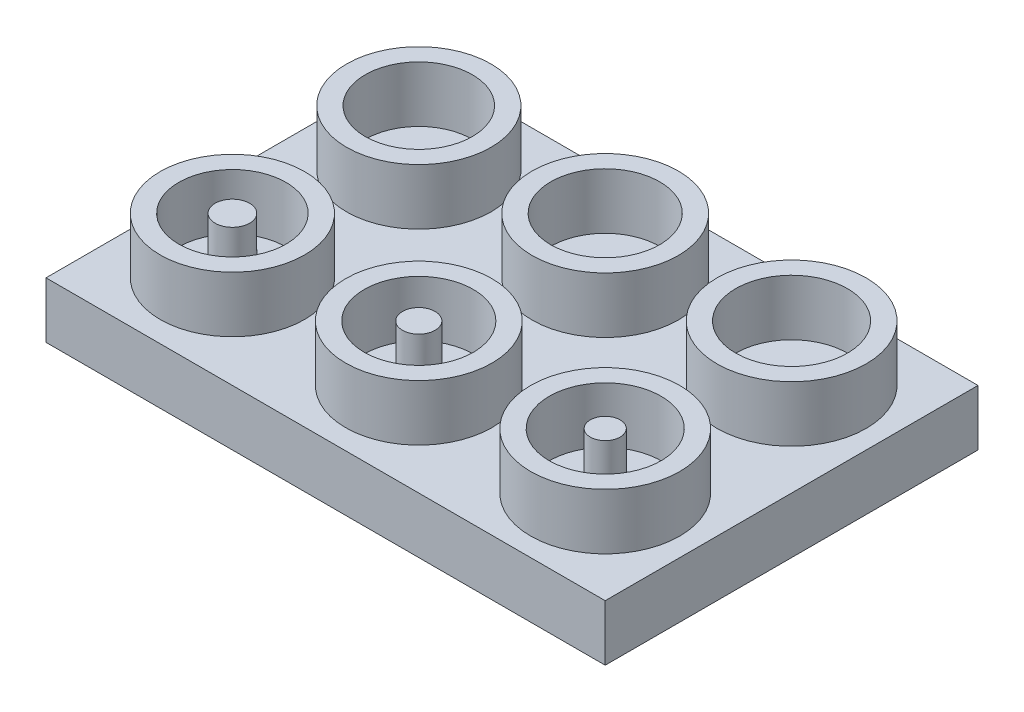
from build123d import *

# Parameters (mm, degrees)
SKETCH1_W           = 30
SKETCH1_H           = 20
BOSS_EXTRUDE1_DEPTH = 3
SKETCH2_R           = 3.875
SKETCH2_R_2         = 2.875
SKETCH2_R_3         = 3.925
SKETCH2_R_4         = 2.925
SKETCH2_R_5         = 4
SKETCH2_R_6         = 3
SKETCH2_R_7         = 0.925
SKETCH2_R_8         = 0.875
SKETCH2_R_9         = 0.8
BOSS_EXTRUDE2_DEPTH = 3
SKETCH4_W           = 3.175
SKETCH4_H           = 0.284935898
SKETCH4_H_2         = 0.284935897
CUT_EXTRUDE1_DEPTH  = 2


with BuildPart() as part:
    # Sketch1 → Boss-Extrude1 (new body)
    with BuildSketch(Plane(origin=(0, 0, 0), x_dir=(1, 0, 0), z_dir=(0, 1, 0))):
        Rectangle(SKETCH1_W, SKETCH1_H)
    extrude(amount=BOSS_EXTRUDE1_DEPTH)

    # Sketch2 → Boss-Extrude2 (add)
    # profile 1 of 9: a face of its own
    with BuildSketch(Plane(origin=(0, 3, 0), x_dir=(1, 0, 0), z_dir=(0, 1, 0))):
        with Locations(Location((-10, 5, 0), (0, 0, 90))):
            Circle(SKETCH2_R)
        with Locations(Location((-10, 5, 0), (0, 0, 270))):
            Circle(SKETCH2_R_2, mode=Mode.SUBTRACT)
    # profile 2 of 9: a face of its own
    with BuildSketch(Plane(origin=(0, 3, 0), x_dir=(1, 0, 0), z_dir=(0, 1, 0))):
        with Locations(Location((0, 5, 0), (0, 0, 90))):
            Circle(SKETCH2_R_3)
        with Locations(Location((0, 5, 0), (0, 0, 270))):
            Circle(SKETCH2_R_4, mode=Mode.SUBTRACT)
    # profile 3 of 9: a face of its own
    with BuildSketch(Plane(origin=(0, 3, 0), x_dir=(1, 0, 0), z_dir=(0, 1, 0))):
        with Locations(Location((10, 5, 0), (0, 0, 90))):
            Circle(SKETCH2_R_5)
        with Locations(Location((10, 5, 0), (0, 0, 270))):
            Circle(SKETCH2_R_6, mode=Mode.SUBTRACT)
    # profile 4 of 9: a face of its own
    with BuildSketch(Plane(origin=(0, 3, 0), x_dir=(1, 0, 0), z_dir=(0, 1, 0))):
        with Locations(Location((-10, -5, 0), (0, 0, 90))):
            Circle(SKETCH2_R)
        with Locations(Location((-10, -5, 0), (0, 0, 270))):
            Circle(SKETCH2_R_2, mode=Mode.SUBTRACT)
    # profile 5 of 9: a face of its own
    with BuildSketch(Plane(origin=(0, 3, 0), x_dir=(1, 0, 0), z_dir=(0, 1, 0))):
        with Locations(Location((-10, -5, 0), (0, 0, 90))):
            Circle(SKETCH2_R_7)
    # profile 6 of 9: a face of its own
    with BuildSketch(Plane(origin=(0, 3, 0), x_dir=(1, 0, 0), z_dir=(0, 1, 0))):
        with Locations(Location((0, -5, 0), (0, 0, 90))):
            Circle(SKETCH2_R_3)
        with Locations(Location((0, -5, 0), (0, 0, 270))):
            Circle(SKETCH2_R_4, mode=Mode.SUBTRACT)
    # profile 7 of 9: a face of its own
    with BuildSketch(Plane(origin=(0, 3, 0), x_dir=(1, 0, 0), z_dir=(0, 1, 0))):
        with Locations(Location((0, -5, 0), (0, 0, 90))):
            Circle(SKETCH2_R_8)
    # profile 8 of 9: a face of its own
    with BuildSketch(Plane(origin=(0, 3, 0), x_dir=(1, 0, 0), z_dir=(0, 1, 0))):
        with Locations(Location((10, -5, 0), (0, 0, 90))):
            Circle(SKETCH2_R_5)
        with Locations(Location((10, -5, 0), (0, 0, 270))):
            Circle(SKETCH2_R_6, mode=Mode.SUBTRACT)
    # profile 9 of 9: a face of its own
    with BuildSketch(Plane(origin=(0, 3, 0), x_dir=(1, 0, 0), z_dir=(0, 1, 0))):
        with Locations(Location((10, -5, 0), (0, 0, 90))):
            Circle(SKETCH2_R_9)
    extrude(amount=BOSS_EXTRUDE2_DEPTH)

    # Sketch4 → Cut-Extrude1 (cut)
    # profile 1 of 16: a face of its own
    with BuildSketch(Plane(origin=(0, 0, 0), x_dir=(-1, 0, 0), z_dir=(0, -1, 0))):
        Polygon((6.825, -6.390705128), (6.825, -6.105769231), (9.674358974, -6.105769231), (9.674358974, -4.884615385), (10, -4.884615385), (10, -6.390705128), align=None)
    # profile 2 of 16: a face of its own
    with BuildSketch(Plane(origin=(0, 0, 0), x_dir=(-1, 0, 0), z_dir=(0, -1, 0))):
        with BuildLine():
            add(Edge.make_bspline(
                [(6.743589744, -2.869711538), (6.745053732, -2.810914918), (6.747929127, -2.695433505), (6.770666469, -2.525868981), (6.808089755, -2.363503347), (6.860939426, -2.20824326), (6.929452383, -2.060679212), (7.012676005, -1.920394444), (7.111116057, -1.787809375), (7.223327043, -1.663836641), (7.346216385, -1.550744787), (7.477771756, -1.451506099), (7.616339159, -1.3677889), (7.76192582, -1.299257254), (7.914191835, -1.24545537), (8.073990577, -1.208338562), (8.240275413, -1.184626813), (8.353692712, -1.181854884), (8.411227965, -1.180448718)],
                knots=[0, 0, 0, 0, 1.065064174, 2.09187391, 3.093564831, 4.079973196, 5.057907931, 6.036227367, 7.030399151, 8.044883615, 9.061699972, 10.052012555, 11.025713132, 11.989727027, 12.962874294, 13.945865945, 14.957962116, 16, 16, 16, 16], degree=3))
            add(Edge.make_bspline(
                [(8.411227965, -1.180448718), (8.468339066, -1.181855358), (8.580911664, -1.184628008), (8.746146033, -1.208357802), (8.904962724, -1.245620987), (9.057007756, -1.298591113), (9.202298725, -1.367175347), (9.340971027, -1.451015791), (9.472877784, -1.550066136), (9.596613733, -1.662677743), (9.709803478, -1.785801191), (9.809641242, -1.916850957), (9.893394885, -2.055414665), (9.962691624, -2.200056385), (10.015372285, -2.351911889), (10.053725545, -2.509876123), (10.077201904, -2.674809729), (10.079992079, -2.787163952), (10.081410256, -2.844270833)],
                knots=[0, 0, 0, 0, 1.043748596, 2.057349401, 3.045489418, 4.02252776, 4.995289225, 5.97782527, 6.980224157, 8.006516136, 9.032559198, 10.034193337, 11.013412982, 11.987833483, 12.961212594, 13.946489799, 14.956251404, 16, 16, 16, 16], degree=3))
            add(Edge.make_bspline(
                [(10.081410256, -2.844270833), (10.080004741, -2.901805751), (10.077234097, -3.01522239), (10.053483822, -3.181716701), (10.016344211, -3.341625797), (9.963267794, -3.494492387), (9.894672163, -3.640401716), (9.811029619, -3.779639148), (9.711781713, -3.911645803), (9.599144891, -4.035327245), (9.476524983, -4.148492589), (9.345139623, -4.247152879), (9.207566459, -4.330814232), (9.063423705, -4.399179541), (8.913408182, -4.453303729), (8.756519206, -4.490228814), (8.593651226, -4.514119285), (8.482759454, -4.516872324), (8.426492388, -4.518269231)],
                knots=[0, 0, 0, 0, 1.053102029, 2.075944431, 3.073151272, 4.055350789, 5.033113405, 6.020478099, 7.024410459, 8.052272461, 9.079885166, 10.07527673, 11.055994387, 12.023226415, 12.992069828, 13.970394897, 14.97016774, 16, 16, 16, 16], degree=3))
            add(Edge.make_bspline(
                [(8.426492388, -4.518269231), (8.388725609, -4.51778424), (8.313668497, -4.516820377), (8.202210939, -4.505216484), (8.092545842, -4.48837837), (7.984985053, -4.464246635), (7.879791874, -4.432685623), (7.776240825, -4.395445569), (7.675381304, -4.349961567), (7.576735513, -4.298544122), (7.481841199, -4.241156624), (7.392143291, -4.177769337), (7.306889101, -4.110608682), (7.228287891, -4.036981889), (7.154053074, -3.959315542), (7.085325466, -3.876349728), (7.021485332, -3.788590692), (6.963954023, -3.695660819), (6.911921094, -3.599849955), (6.867269843, -3.501083164), (6.82894663, -3.400701845), (6.79788531, -3.298235843), (6.773363392, -3.193957257), (6.756665292, -3.087638495), (6.745031804, -2.979364259), (6.744072499, -2.906419705), (6.743589744, -2.869711538)],
                knots=[0, 0, 0, 0, 1.037015668, 2.060948919, 3.074880161, 4.083647147, 5.086022904, 6.090072063, 7.104153813, 8.122640571, 9.144368836, 10.147691507, 11.138137339, 12.123020368, 13.103399296, 14.087645067, 15.080126199, 16.082011238, 17.087798457, 18.072939717, 19.057185487, 20.037253025, 21.01195951, 21.997135196, 22.992090687, 24, 24, 24, 24], degree=3))
        make_face()
        with BuildLine():
            add(Edge.make_bspline(
                [(7.069230769, -2.855719151), (7.069596782, -2.885849954), (7.070325307, -2.945823507), (7.079974217, -3.034975925), (7.093627875, -3.122982915), (7.113457775, -3.209674172), (7.139106888, -3.295231504), (7.170041743, -3.379692894), (7.207431151, -3.462768753), (7.249480084, -3.544355294), (7.297240944, -3.622568137), (7.347958314, -3.697595641), (7.403516616, -3.767486276), (7.46271432, -3.833200144), (7.526065168, -3.894573821), (7.593153129, -3.951580236), (7.664268376, -4.004172642), (7.73911824, -4.051718112), (7.817284818, -4.094029868), (7.897273901, -4.131913358), (7.980025528, -4.163317325), (8.065023303, -4.188193946), (8.151892661, -4.209308497), (8.241106896, -4.222553106), (8.332358456, -4.232297088), (8.394028061, -4.232985259), (8.425220353, -4.233333333)],
                knots=[0, 0, 0, 0, 1.008406545, 2.007172654, 2.999155034, 3.989332444, 4.982025741, 5.988181096, 6.998684226, 8.030553839, 9.059268815, 10.065399129, 11.060956322, 12.046057109, 13.024974577, 14.012068307, 14.991706172, 15.984221787, 16.978487447, 17.966117052, 18.945677757, 19.938371053, 20.93015022, 21.936155317, 22.956113857, 24, 24, 24, 24], degree=3))
            add(Edge.make_bspline(
                [(8.425220353, -4.233333333), (8.471086467, -4.232174205), (8.561319304, -4.229893842), (8.693566713, -4.210012941), (8.82078581, -4.179145879), (8.94221832, -4.134394468), (9.058405743, -4.077305214), (9.16889592, -4.007667914), (9.273656257, -3.924844836), (9.371906919, -3.830820429), (9.46154849, -3.728007218), (9.540343902, -3.618887045), (9.606660318, -3.504323229), (9.662099352, -3.384976085), (9.703864813, -3.259826648), (9.733643568, -3.129677329), (9.752944025, -2.99452525), (9.754818558, -2.902426941), (9.755769231, -2.855719151)],
                knots=[0, 0, 0, 0, 1.032022337, 2.030307203, 3.003823408, 3.974715386, 4.937372378, 5.913284036, 6.909147208, 7.938749767, 8.970518239, 9.975863271, 10.963918693, 11.946286286, 12.933361397, 13.927862637, 14.949112547, 16, 16, 16, 16], degree=3))
            add(Edge.make_bspline(
                [(9.755769231, -2.855719151), (9.755338228, -2.824323265), (9.754483421, -2.762055794), (9.745861665, -2.669442381), (9.732063322, -2.57848888), (9.712098419, -2.489363342), (9.687441963, -2.401948994), (9.65685817, -2.316509595), (9.620195533, -2.233073524), (9.579336237, -2.151230506), (9.532921178, -2.072813087), (9.482887526, -1.998240684), (9.428309529, -1.92847046), (9.369906876, -1.862787424), (9.306750767, -1.801843872), (9.240070525, -1.744999765), (9.168804343, -1.693316697), (9.094261047, -1.645932408), (9.016664351, -1.603104383), (8.936455361, -1.566316684), (8.854064264, -1.534899228), (8.769430526, -1.509573199), (8.682744523, -1.489717497), (8.593882189, -1.476038524), (8.503023455, -1.466469403), (8.441570086, -1.465748179), (8.410591947, -1.465384615)],
                knots=[0, 0, 0, 0, 1.047334373, 2.07717862, 3.100662057, 4.115010574, 5.122652213, 6.129548646, 7.140165612, 8.16200981, 9.179904151, 10.178566626, 11.156366481, 12.133321541, 13.108841334, 14.082538371, 15.054589433, 16.043660176, 17.028268541, 18.009491307, 18.985652105, 19.968123554, 20.954864208, 21.950389976, 22.966808393, 24, 24, 24, 24], degree=3))
            add(Edge.make_bspline(
                [(8.410591947, -1.465384615), (8.37982574, -1.465748482), (8.3187953, -1.466470279), (8.228570129, -1.476033809), (8.140347573, -1.489732474), (8.05447398, -1.50947436), (7.97092746, -1.534919855), (7.889786487, -1.566295508), (7.810748748, -1.603293589), (7.734009707, -1.645755384), (7.660372357, -1.693485271), (7.589976871, -1.745641437), (7.524139338, -1.803120344), (7.461256664, -1.864294788), (7.402586635, -1.930635533), (7.34835594, -2.002154158), (7.296121127, -2.077069942), (7.249892738, -2.157077051), (7.206987153, -2.239351069), (7.170382103, -2.323851102), (7.13894355, -2.409370364), (7.113381207, -2.496250777), (7.093703833, -2.584451276), (7.079961999, -2.673920567), (7.070328621, -2.764346353), (7.069597881, -2.825164899), (7.069230769, -2.855719151)],
                knots=[0, 0, 0, 0, 1.029877221, 2.042951179, 3.035109885, 4.018542222, 4.991021277, 5.957494829, 6.929429462, 7.911425532, 8.892163142, 9.866273635, 10.842761649, 11.81676864, 12.802607151, 13.805177466, 14.821356543, 15.858816981, 16.897175917, 17.927346774, 18.940346092, 19.946830556, 20.957962087, 21.964146003, 22.97721996, 24, 24, 24, 24], degree=3))
        make_face(mode=Mode.SUBTRACT)
    # profile 3 of 16: a face of its own
    with BuildSketch(Plane(origin=(0, 0, 0), x_dir=(-1, 0, 0), z_dir=(0, -1, 0))):
        Polygon((6.825, -0.732692308), (6.825, -0.438216146), (9.153460537, 0.183173077), (6.825, 1.107306691), (6.825, 1.148647837), (9.137560096, 2.055608974), (6.825, 2.680178285), (6.825, 2.971474359), (10, 2.115394631), (10, 2.074689503), (7.571684696, 1.119391026), (10, 0.152644231), (10, 0.111939103), align=None)
    # profile 4 of 16: a face of its own
    with BuildSketch(Plane(origin=(0, 0, 0), x_dir=(-1, 0, 0), z_dir=(0, -1, 0))):
        with BuildLine():
            add(Edge.make_bspline(
                [(8.413772035, 4.640384615), (8.362883691, 4.640682175), (8.264032348, 4.641260188), (8.119991994, 4.647690398), (7.984863732, 4.658372316), (7.858641094, 4.673011219), (7.741291491, 4.690825671), (7.63312854, 4.714606869), (7.533651586, 4.741651317), (7.442536383, 4.772995399), (7.358554894, 4.808362626), (7.280155901, 4.846857504), (7.207452134, 4.890002228), (7.139304243, 4.935350367), (7.076753039, 4.984667318), (7.019077814, 5.036895632), (6.966764954, 5.093079882), (6.919778634, 5.152675133), (6.878578488, 5.21527748), (6.842064493, 5.279176236), (6.811988111, 5.345513128), (6.787384802, 5.413414868), (6.767300553, 5.483024569), (6.753504732, 5.554324459), (6.744839858, 5.627479816), (6.744010402, 5.676856614), (6.743589744, 5.701898037)],
                knots=[0, 0, 0, 0, 1.646148282, 3.197666765, 4.66315463, 6.030252048, 7.307778049, 8.501004361, 9.610818041, 10.641065266, 11.615491391, 12.557119604, 13.464013759, 14.348536654, 15.203310953, 16.038349431, 16.863300206, 17.683791446, 18.490318933, 19.285717724, 20.06220424, 20.843281102, 21.620494212, 22.403315558, 23.190242141, 24, 24, 24, 24], degree=3))
            add(Edge.make_bspline(
                [(6.743589744, 5.701898037), (6.743940127, 5.727161038), (6.744637268, 5.777425519), (6.75444994, 5.851471189), (6.76711544, 5.92422711), (6.787428816, 5.994589431), (6.811736404, 6.063888568), (6.843809882, 6.13040119), (6.878692279, 6.196475544), (6.921245869, 6.259109963), (6.968274589, 6.320175846), (7.021664209, 6.377418736), (7.079937166, 6.432301913), (7.144393116, 6.482752463), (7.21404376, 6.530932624), (7.28947297, 6.57501343), (7.370513584, 6.615911681), (7.456789911, 6.654396155), (7.550606524, 6.688049812), (7.651378265, 6.717970603), (7.76001767, 6.742495754), (7.875919549, 6.762777622), (7.999658079, 6.778520213), (8.130982551, 6.789977404), (8.269975122, 6.796031534), (8.365005487, 6.797171445), (8.413772035, 6.79775641)],
                knots=[0, 0, 0, 0, 0.810910589, 1.61342667, 2.396193133, 3.181089899, 3.963115317, 4.752255436, 5.550715454, 6.36105385, 7.181178335, 8.024612154, 8.872680183, 9.750181803, 10.651284446, 11.591556747, 12.554036451, 13.566402641, 14.62422919, 15.753422176, 16.94128843, 18.199818041, 19.531985927, 20.947085226, 22.433341622, 24, 24, 24, 24], degree=3))
            add(Edge.make_bspline(
                [(8.413772035, 6.79775641), (8.462325441, 6.797158575), (8.557141539, 6.79599111), (8.695515231, 6.790107249), (8.826131835, 6.778240367), (8.949130608, 6.763612941), (9.064568578, 6.743104384), (9.172370524, 6.718393269), (9.272918116, 6.690238628), (9.365490942, 6.656068478), (9.451617553, 6.618479761), (9.532062281, 6.577625398), (9.607471571, 6.533793347), (9.677305929, 6.486335776), (9.741503164, 6.435055366), (9.799975986, 6.380210657), (9.853705187, 6.322467969), (9.901252024, 6.261046083), (9.944129596, 6.197828263), (9.980277855, 6.131747196), (10.011598201, 6.064494072), (10.037205473, 5.995397434), (10.057064212, 5.924563963), (10.070716013, 5.851758175), (10.08031218, 5.77741507), (10.081042964, 5.727157543), (10.081410256, 5.701898037)],
                knots=[0, 0, 0, 0, 1.561645053, 3.049612875, 4.452756685, 5.778837748, 7.032101753, 8.221335837, 9.334924186, 10.387562255, 11.392109817, 12.355697819, 13.287721948, 14.19548756, 15.068665045, 15.927346723, 16.771751757, 17.602390507, 18.423119567, 19.225778204, 20.022010933, 20.807278863, 21.593079439, 22.384715467, 23.188155646, 24, 24, 24, 24], degree=3))
            add(Edge.make_bspline(
                [(10.081410256, 5.701898037), (10.080987205, 5.676857162), (10.080153031, 5.627481445), (10.071522718, 5.554318173), (10.057647511, 5.483304814), (10.038219593, 5.414090942), (10.014438985, 5.346321471), (9.983456742, 5.280919799), (9.947775018, 5.217158983), (9.907139569, 5.155208197), (9.860581952, 5.096235128), (9.809094419, 5.039894255), (9.751356655, 4.987653061), (9.68827768, 4.938763733), (9.620028397, 4.892936183), (9.546563005, 4.850164286), (9.46775606, 4.810862141), (9.383110858, 4.774890671), (9.29134896, 4.742997949), (9.191618431, 4.714935468), (9.082906305, 4.692522826), (8.965764536, 4.673524648), (8.8399551, 4.658301158), (8.705432482, 4.647694834), (8.562452128, 4.64126507), (8.464236452, 4.640683456), (8.413772035, 4.640384615)],
                knots=[0, 0, 0, 0, 0.810927267, 1.598990287, 2.382942141, 3.152806972, 3.926217614, 4.706701772, 5.493896336, 6.292070767, 7.104102563, 7.925577746, 8.761822141, 9.623241997, 10.509042271, 11.423174113, 12.375371989, 13.360203808, 14.400680605, 15.520553799, 16.714061498, 17.994519714, 19.364400916, 20.818312473, 22.365209998, 24, 24, 24, 24], degree=3))
        make_face()
        with BuildLine():
            add(Edge.make_bspline(
                [(8.4125, 4.925320513), (8.454907579, 4.925431244), (8.537212362, 4.925646153), (8.656603995, 4.931097997), (8.768147671, 4.938686409), (8.871799856, 4.948233068), (8.967198289, 4.962530547), (9.054739575, 4.978751911), (9.134261677, 4.998208447), (9.206459525, 5.021342534), (9.272355467, 5.04769451), (9.333705866, 5.076415721), (9.391237837, 5.107543878), (9.4448118, 5.141717041), (9.493772872, 5.179610838), (9.539362103, 5.219468507), (9.579993941, 5.263085615), (9.628733605, 5.323411327), (9.679096573, 5.403056538), (9.72295363, 5.503404712), (9.750514796, 5.606518331), (9.754019783, 5.676505524), (9.755769231, 5.711438301)],
                knots=[0, 0, 0, 0, 1.459098681, 2.831824031, 4.11146945, 5.306290378, 6.412266529, 7.42953815, 8.369053297, 9.227277979, 10.03601793, 10.809473603, 11.557037441, 12.285528272, 12.993193355, 13.685654407, 14.36688038, 15.041354379, 16.352855396, 17.594313975, 18.799247529, 20, 20, 20, 20], degree=3))
            add(Edge.make_bspline(
                [(9.755769231, 5.711438301), (9.75423738, 5.746573291), (9.751179113, 5.81671864), (9.724487765, 5.919737539), (9.681096109, 6.018921351), (9.631522171, 6.097196165), (9.584009028, 6.156581001), (9.543546211, 6.199144956), (9.498226589, 6.238207401), (9.449332926, 6.275257271), (9.395926979, 6.309237928), (9.338266698, 6.340138082), (9.276191642, 6.368335112), (9.232857667, 6.384399748), (9.210702123, 6.392613181)],
                knots=[0, 0, 0, 0, 1.353621445, 2.702441307, 4.075953605, 5.516772412, 6.261413105, 7.007624062, 7.778524365, 8.566925914, 9.372323995, 10.217594641, 11.088702136, 12, 12, 12, 12], degree=3))
            add(Edge.make_bspline(
                [(9.210702123, 6.392613181), (9.182372288, 6.402185142), (9.124850574, 6.421620327), (9.035620689, 6.446668151), (8.942001039, 6.466394335), (8.844551112, 6.484141102), (8.74255224, 6.496254231), (8.63632002, 6.506004033), (8.525774356, 6.511746871), (8.450667471, 6.512458752), (8.4125, 6.512820513)],
                knots=[0, 0, 0, 0, 0.884706709, 1.796334032, 2.740027952, 3.714592787, 4.726048262, 5.777819803, 6.87074269, 8, 8, 8, 8], degree=3))
            add(Edge.make_bspline(
                [(8.4125, 6.512820513), (8.374338702, 6.512321413), (8.299687045, 6.511345066), (8.190359839, 6.507613091), (8.086521227, 6.497975992), (7.98772387, 6.487272505), (7.894514665, 6.471490742), (7.806113324, 6.454474724), (7.723614983, 6.431613649), (7.645728166, 6.407193481), (7.573337263, 6.379244352), (7.50610654, 6.348476897), (7.44370523, 6.315622219), (7.386326138, 6.279920493), (7.333636439, 6.241869008), (7.286848519, 6.200103451), (7.243686403, 6.157276244), (7.195298485, 6.096366929), (7.145571911, 6.017274331), (7.101055337, 5.918177539), (7.074709227, 5.815616632), (7.071055605, 5.746139373), (7.069230769, 5.711438301)],
                knots=[0, 0, 0, 0, 1.313483664, 2.569454835, 3.763100662, 4.901599063, 5.988328865, 7.015709358, 7.99797933, 8.932480776, 9.824041341, 10.666387587, 11.475829342, 12.24921787, 12.990555181, 13.709176526, 14.405678811, 15.080244297, 16.38186033, 17.610124501, 18.806354173, 20, 20, 20, 20], degree=3))
            add(Edge.make_bspline(
                [(7.069230769, 5.711438301), (7.071060145, 5.67631693), (7.07472223, 5.606010204), (7.100933494, 5.502354042), (7.145441664, 5.402587792), (7.195202681, 5.323234375), (7.243500879, 5.263065006), (7.284608206, 5.22036741), (7.32910856, 5.179956969), (7.378503972, 5.143044428), (7.431889166, 5.109073902), (7.488677149, 5.076742753), (7.55014218, 5.048405621), (7.615986452, 5.021969043), (7.68818827, 4.998796369), (7.767998111, 4.979562145), (7.855748452, 4.962051659), (7.95184392, 4.949441255), (8.055518227, 4.938336956), (8.167347158, 4.931181304), (8.287148771, 4.925621177), (8.369879385, 4.925422742), (8.4125, 4.925320513)],
                knots=[0, 0, 0, 0, 1.207546505, 2.417292871, 3.651582144, 4.952510111, 5.626719005, 6.30238548, 6.989136872, 7.692112372, 8.420316868, 9.164734959, 9.937886623, 10.746308695, 11.604196049, 12.543341915, 13.568754172, 14.680483261, 15.875568977, 17.154711427, 18.534182925, 20, 20, 20, 20], degree=3))
        make_face(mode=Mode.SUBTRACT)
    # profile 5 of 16: a face of its own
    with BuildSketch(Plane(origin=(0, 0, 0), x_dir=(-1, 0, 0), z_dir=(0, -1, 0))):
        Polygon((-13.175, -6.512820513), (-13.175, -6.227884615), (-11.872435897, -6.227884615), (-11.872435897, -4.599679487), (-13.175, -4.599679487), (-13.175, -4.31474359), (-10, -4.31474359), (-10, -4.599679487), (-11.546794872, -4.599679487), (-11.546794872, -6.227884615), (-10, -6.227884615), (-10, -6.512820513), align=None)
    # profile 6 of 16: a face of its own
    with BuildSketch(Plane(origin=(0, 0, 0), x_dir=(-1, 0, 0), z_dir=(0, -1, 0))):
        with Locations((-11.5875, -3.358173077)):
            Rectangle(SKETCH4_W, SKETCH4_H)
    # profile 7 of 16: a face of its own
    with BuildSketch(Plane(origin=(0, 0, 0), x_dir=(-1, 0, 0), z_dir=(0, -1, 0))):
        with BuildLine():
            add(Edge.make_bspline(
                [(-11.586227965, -1.5875), (-11.637116309, -1.587202441), (-11.735967652, -1.586624427), (-11.880008006, -1.580194217), (-12.015136268, -1.569512299), (-12.141358906, -1.554873396), (-12.258708509, -1.537058945), (-12.36687146, -1.513277747), (-12.466348414, -1.486233299), (-12.557463617, -1.454889217), (-12.641445106, -1.419521989), (-12.719844099, -1.381027111), (-12.792547866, -1.337882387), (-12.860695757, -1.292534249), (-12.923246961, -1.243217298), (-12.980922186, -1.190988984), (-13.033235046, -1.134804733), (-13.080221366, -1.075209482), (-13.121421512, -1.012607135), (-13.157935507, -0.94870838), (-13.188011889, -0.882371488), (-13.212615198, -0.814469747), (-13.232699447, -0.744860047), (-13.246495268, -0.673560157), (-13.255160142, -0.600404799), (-13.255989598, -0.551028001), (-13.256410256, -0.525986579)],
                knots=[0, 0, 0, 0, 1.646148282, 3.197666765, 4.66315463, 6.030252048, 7.307778049, 8.501004361, 9.610818041, 10.641065266, 11.615491391, 12.557119604, 13.464013759, 14.348536654, 15.203310953, 16.038349431, 16.863300206, 17.683791446, 18.490318933, 19.285717724, 20.06220424, 20.843281102, 21.620494212, 22.403315558, 23.190242141, 24, 24, 24, 24], degree=3))
            add(Edge.make_bspline(
                [(-13.256410256, -0.525986579), (-13.256059873, -0.500723577), (-13.255362732, -0.450459096), (-13.24555006, -0.376413426), (-13.23288456, -0.303657505), (-13.212571184, -0.233295185), (-13.188263596, -0.163996048), (-13.156190118, -0.097483426), (-13.121307721, -0.031409071), (-13.078754131, 0.031225347), (-13.031725411, 0.092291231), (-12.978335791, 0.14953412), (-12.920062834, 0.204417298), (-12.855606884, 0.254867848), (-12.78595624, 0.303048009), (-12.71052703, 0.347128815), (-12.629486416, 0.388027066), (-12.543210089, 0.42651154), (-12.449393476, 0.460165197), (-12.348621735, 0.490085987), (-12.23998233, 0.514611138), (-12.124080451, 0.534893007), (-12.000341921, 0.550635598), (-11.869017449, 0.562092789), (-11.730024878, 0.568146919), (-11.634994513, 0.569286829), (-11.586227965, 0.569871795)],
                knots=[0, 0, 0, 0, 0.810910589, 1.61342667, 2.396193133, 3.181089899, 3.963115317, 4.752255436, 5.550715454, 6.36105385, 7.181178335, 8.024612154, 8.872680183, 9.750181803, 10.651284446, 11.591556747, 12.554036451, 13.566402641, 14.62422919, 15.753422176, 16.94128843, 18.199818041, 19.531985927, 20.947085226, 22.433341622, 24, 24, 24, 24], degree=3))
            add(Edge.make_bspline(
                [(-11.586227965, 0.569871795), (-11.537674559, 0.56927396), (-11.442858461, 0.568106495), (-11.304484769, 0.562222633), (-11.173868165, 0.550355751), (-11.050869392, 0.535728326), (-10.935431422, 0.515219769), (-10.827629476, 0.490508654), (-10.727081884, 0.462354013), (-10.634509058, 0.428183863), (-10.548382447, 0.390595146), (-10.467937719, 0.349740782), (-10.392528429, 0.305908731), (-10.322694071, 0.25845116), (-10.258496836, 0.207170751), (-10.200024014, 0.152326041), (-10.146294813, 0.094583354), (-10.098747976, 0.033161467), (-10.055870404, -0.030056352), (-10.019722145, -0.09613742), (-9.988401799, -0.163390543), (-9.962794527, -0.232487181), (-9.942935788, -0.303320652), (-9.929283987, -0.376126441), (-9.91968782, -0.450469546), (-9.918957036, -0.500727072), (-9.918589744, -0.525986579)],
                knots=[0, 0, 0, 0, 1.561645053, 3.049612875, 4.452756685, 5.778837748, 7.032101753, 8.221335837, 9.334924186, 10.387562255, 11.392109817, 12.355697819, 13.287721948, 14.19548756, 15.068665045, 15.927346723, 16.771751757, 17.602390507, 18.423119567, 19.225778204, 20.022010933, 20.807278863, 21.593079439, 22.384715467, 23.188155646, 24, 24, 24, 24], degree=3))
            add(Edge.make_bspline(
                [(-9.918589744, -0.525986579), (-9.919012795, -0.551027453), (-9.919846969, -0.600403171), (-9.928477282, -0.673566443), (-9.942352489, -0.744579801), (-9.961780407, -0.813793674), (-9.985561015, -0.881563145), (-10.016543258, -0.946964817), (-10.052224982, -1.010725633), (-10.092860431, -1.072676418), (-10.139418048, -1.131649487), (-10.190905581, -1.187990361), (-10.248643345, -1.240231554), (-10.31172232, -1.289120883), (-10.379971603, -1.334948432), (-10.453436995, -1.377720329), (-10.53224394, -1.417022474), (-10.616889142, -1.452993944), (-10.70865104, -1.484886666), (-10.808381569, -1.512949147), (-10.917093695, -1.535361789), (-11.034235464, -1.554359968), (-11.1600449, -1.569583457), (-11.294567518, -1.580189781), (-11.437547872, -1.586619546), (-11.535763548, -1.58720116), (-11.586227965, -1.5875)],
                knots=[0, 0, 0, 0, 0.810927267, 1.598990287, 2.382942141, 3.152806972, 3.926217614, 4.706701772, 5.493896336, 6.292070767, 7.104102563, 7.925577746, 8.761822141, 9.623241997, 10.509042271, 11.423174113, 12.375371989, 13.360203808, 14.400680605, 15.520553799, 16.714061498, 17.994519714, 19.364400916, 20.818312473, 22.365209998, 24, 24, 24, 24], degree=3))
        make_face()
        with BuildLine():
            add(Edge.make_bspline(
                [(-11.5875, -1.302564103), (-11.545092421, -1.302453371), (-11.462787638, -1.302238463), (-11.343396005, -1.296786618), (-11.231852329, -1.289198206), (-11.128200144, -1.279651548), (-11.032801711, -1.265354069), (-10.945260425, -1.249132704), (-10.865738323, -1.229676168), (-10.793540475, -1.206542081), (-10.727644533, -1.180190105), (-10.666294134, -1.151468895), (-10.608762163, -1.120340737), (-10.5551882, -1.086167574), (-10.506227128, -1.048273778), (-10.460637897, -1.008416109), (-10.420006059, -0.964799001), (-10.371266395, -0.904473288), (-10.320903427, -0.824828077), (-10.27704637, -0.724479904), (-10.249485204, -0.621366284), (-10.245980217, -0.551379092), (-10.244230769, -0.516446314)],
                knots=[0, 0, 0, 0, 1.459098681, 2.831824031, 4.11146945, 5.306290378, 6.412266529, 7.42953815, 8.369053297, 9.227277979, 10.03601793, 10.809473603, 11.557037441, 12.285528272, 12.993193355, 13.685654407, 14.36688038, 15.041354379, 16.352855396, 17.594313975, 18.799247529, 20, 20, 20, 20], degree=3))
            add(Edge.make_bspline(
                [(-10.244230769, -0.516446314), (-10.24576262, -0.481311324), (-10.248820887, -0.411165976), (-10.275512235, -0.308147077), (-10.318903891, -0.208963264), (-10.368477829, -0.130688451), (-10.415990972, -0.071303614), (-10.456453789, -0.02873966), (-10.501773411, 0.010322786), (-10.550667074, 0.047372656), (-10.604073021, 0.081353312), (-10.661733302, 0.112253466), (-10.723808358, 0.140450497), (-10.767142333, 0.156515132), (-10.789297877, 0.164728566)],
                knots=[0, 0, 0, 0, 1.353621445, 2.702441307, 4.075953605, 5.516772412, 6.261413105, 7.007624062, 7.778524365, 8.566925914, 9.372323995, 10.217594641, 11.088702136, 12, 12, 12, 12], degree=3))
            add(Edge.make_bspline(
                [(-10.789297877, 0.164728566), (-10.817627712, 0.174300526), (-10.875149426, 0.193735712), (-10.964379311, 0.218783536), (-11.057998961, 0.238509719), (-11.155448888, 0.256256487), (-11.25744776, 0.268369616), (-11.36367998, 0.278119418), (-11.474225644, 0.283862256), (-11.549332529, 0.284574137), (-11.5875, 0.284935897)],
                knots=[0, 0, 0, 0, 0.884706709, 1.796334032, 2.740027952, 3.714592787, 4.726048262, 5.777819803, 6.87074269, 8, 8, 8, 8], degree=3))
            add(Edge.make_bspline(
                [(-11.5875, 0.284935897), (-11.625661298, 0.284436797), (-11.700312955, 0.28346045), (-11.809640161, 0.279728476), (-11.913478773, 0.270091376), (-12.01227613, 0.259387889), (-12.105485335, 0.243606127), (-12.193886676, 0.226590109), (-12.276385017, 0.203729034), (-12.354271834, 0.179308866), (-12.426662737, 0.151359736), (-12.49389346, 0.120592281), (-12.55629477, 0.087737604), (-12.613673862, 0.052035878), (-12.666363561, 0.013984392), (-12.713151481, -0.027781165), (-12.756313597, -0.070608371), (-12.804701515, -0.131517686), (-12.854428089, -0.210610285), (-12.898944663, -0.309707076), (-12.925290773, -0.412267984), (-12.928944395, -0.481745243), (-12.930769231, -0.516446314)],
                knots=[0, 0, 0, 0, 1.313483664, 2.569454835, 3.763100662, 4.901599063, 5.988328865, 7.015709358, 7.99797933, 8.932480776, 9.824041341, 10.666387587, 11.475829342, 12.24921787, 12.990555181, 13.709176526, 14.405678811, 15.080244297, 16.38186033, 17.610124501, 18.806354173, 20, 20, 20, 20], degree=3))
            add(Edge.make_bspline(
                [(-12.930769231, -0.516446314), (-12.928939855, -0.551567686), (-12.92527777, -0.621874411), (-12.899066506, -0.725530573), (-12.854558336, -0.825296824), (-12.804797319, -0.904650241), (-12.756499121, -0.96481961), (-12.715391794, -1.007517205), (-12.67089144, -1.047927646), (-12.621496028, -1.084840187), (-12.568110834, -1.118810713), (-12.511322851, -1.151141862), (-12.44985782, -1.179478995), (-12.384013548, -1.205915573), (-12.31181173, -1.229088247), (-12.232001889, -1.24832247), (-12.144251548, -1.265832957), (-12.04815608, -1.278443361), (-11.944481773, -1.289547659), (-11.832652842, -1.296703311), (-11.712851229, -1.302263438), (-11.630120615, -1.302461874), (-11.5875, -1.302564103)],
                knots=[0, 0, 0, 0, 1.207546505, 2.417292871, 3.651582144, 4.952510111, 5.626719005, 6.30238548, 6.989136872, 7.692112372, 8.420316868, 9.164734959, 9.937886623, 10.746308695, 11.604196049, 12.543341915, 13.568754172, 14.680483261, 15.875568977, 17.154711427, 18.534182925, 20, 20, 20, 20], degree=3))
        make_face(mode=Mode.SUBTRACT)
    # profile 8 of 16: a face of its own
    with BuildSketch(Plane(origin=(0, 0, 0), x_dir=(-1, 0, 0), z_dir=(0, -1, 0))):
        with BuildLine():
            add(Edge.make_bspline(
                [(-10.488461538, 1.363621795), (-10.487410916, 1.381302202), (-10.485351293, 1.415962572), (-10.471221025, 1.466072353), (-10.446130668, 1.511424651), (-10.412690862, 1.551821759), (-10.372145511, 1.585119777), (-10.327154936, 1.611104296), (-10.276625635, 1.625111476), (-10.241764429, 1.627156096), (-10.223878205, 1.628205128)],
                knots=[0, 0, 0, 0, 1.020151414, 1.999887582, 2.974338812, 3.990962822, 5.007586832, 5.987933904, 6.967670073, 8, 8, 8, 8], degree=3))
            add(Edge.make_bspline(
                [(-10.223878205, 1.628205128), (-10.206418759, 1.627123888), (-10.171988988, 1.624991698), (-10.121884184, 1.611097977), (-10.07684201, 1.585151321), (-10.036391694, 1.5516099), (-10.002144202, 1.511666238), (-9.977386488, 1.465930464), (-9.962195869, 1.416089288), (-9.960273699, 1.381324891), (-9.959294872, 1.363621795)],
                knots=[0, 0, 0, 0, 1.009624703, 1.990965087, 2.972917375, 3.991206001, 5.017354006, 5.993400798, 6.978178195, 8, 8, 8, 8], degree=3))
            add(Edge.make_bspline(
                [(-9.959294872, 1.363621795), (-9.960238167, 1.345905949), (-9.962079728, 1.311319977), (-9.977696975, 1.261664621), (-10.001907954, 1.215650085), (-10.03645404, 1.175716803), (-10.076632777, 1.141903575), (-10.122194385, 1.117108058), (-10.171845395, 1.102009692), (-10.206390475, 1.100037064), (-10.223878205, 1.099038462)],
                knots=[0, 0, 0, 0, 1.022258411, 1.995716197, 2.98297171, 4.009558169, 5.028281891, 6.00474573, 6.989943903, 8, 8, 8, 8], degree=3))
            add(Edge.make_bspline(
                [(-10.223878205, 1.099038462), (-10.241793714, 1.100001937), (-10.276771546, 1.101883005), (-10.326845022, 1.117100926), (-10.372354963, 1.141935061), (-10.412629004, 1.175504241), (-10.4463632, 1.215894138), (-10.470914834, 1.261519981), (-10.485465779, 1.311448707), (-10.487445633, 1.345929151), (-10.488461538, 1.363621795)],
                knots=[0, 0, 0, 0, 1.032775665, 2.016367738, 2.991239715, 4.008302682, 5.025365648, 6.011011707, 6.979408107, 8, 8, 8, 8], degree=3))
        make_face()
    # profile 9 of 16: a face of its own
    with BuildSketch(Plane(origin=(0, 0, 0), x_dir=(-1, 0, 0), z_dir=(0, -1, 0))):
        with BuildLine():
            Line((-12.198076923, 2.483012821), (-12.198076923, 2.198076923))
            add(Edge.make_bspline(
                [(-12.198076923, 2.198076923), (-12.235878371, 2.199933983), (-12.310119409, 2.2035812), (-12.418363239, 2.220661148), (-12.521827235, 2.245100373), (-12.619680657, 2.279654763), (-12.712788718, 2.322568315), (-12.800781589, 2.374030554), (-12.883323596, 2.434984976), (-12.959649547, 2.50411537), (-13.0296697, 2.57919835), (-13.090135528, 2.660211595), (-13.141223701, 2.745342441), (-13.183933113, 2.83433261), (-13.215991402, 2.928186121), (-13.239778175, 3.026051285), (-13.254089574, 3.128358073), (-13.255627894, 3.19806295), (-13.256410256, 3.233513622)],
                knots=[0, 0, 0, 0, 1.10065271, 2.161652631, 3.183658789, 4.190468796, 5.17591951, 6.163126047, 7.15150782, 8.156236427, 9.156009102, 10.134482811, 11.092018607, 12.041330605, 13.001268258, 13.972401359, 14.968799086, 16, 16, 16, 16], degree=3))
            add(Edge.make_bspline(
                [(-13.256410256, 3.233513622), (-13.255601842, 3.268330468), (-13.254013337, 3.336744326), (-13.240166552, 3.436551637), (-13.218947588, 3.531791748), (-13.187504427, 3.621385305), (-13.148050137, 3.706251788), (-13.098983559, 3.785340411), (-13.042626357, 3.860563617), (-12.976150274, 3.928229584), (-12.905220126, 3.990388938), (-12.829467324, 4.043966543), (-12.751136594, 4.090107998), (-12.669616059, 4.127873338), (-12.584640249, 4.156501144), (-12.497023856, 4.177711606), (-12.405755728, 4.189836651), (-12.343971575, 4.191687315), (-12.312560096, 4.192628205)],
                knots=[0, 0, 0, 0, 1.111674182, 2.184400057, 3.212814286, 4.223731311, 5.211378316, 6.196328225, 7.191884489, 8.207283132, 9.220262353, 10.201199469, 11.166417575, 12.120932471, 13.06540007, 14.026332106, 14.996573967, 16, 16, 16, 16], degree=3))
            add(Edge.make_bspline(
                [(-12.312560096, 4.192628205), (-12.268338865, 4.19109215), (-12.180672423, 4.188046994), (-12.051844376, 4.161999307), (-11.927028551, 4.121315768), (-11.826570574, 4.072336792), (-11.745630711, 4.022912788), (-11.678955924, 3.97841913), (-11.607183995, 3.92603572), (-11.530024429, 3.866210099), (-11.448487696, 3.797911984), (-11.360910227, 3.722915751), (-11.26891139, 3.639284597), (-11.206034008, 3.580639053), (-11.173452524, 3.550250401)],
                knots=[0, 0, 0, 0, 1.184416499, 2.348048165, 3.509039915, 4.696071444, 5.333504901, 6.05069495, 6.844171097, 7.714965912, 8.667477798, 9.695072654, 10.805644396, 12, 12, 12, 12], degree=3))
            Line((-11.173452524, 3.550250401), (-10.325641026, 2.755864383))
            Line((-10.325641026, 2.755864383), (-10.325641026, 4.233333333))
            Line((-10.325641026, 4.233333333), (-10, 4.233333333))
            Line((-10, 4.233333333), (-10, 2.075961538))
            Line((-10, 2.075961538), (-11.31401242, 3.307291667))
            add(Edge.make_bspline(
                [(-11.31401242, 3.307291667), (-11.345307312, 3.337270821), (-11.405418396, 3.394854641), (-11.493178081, 3.476300265), (-11.574593736, 3.549451347), (-11.649511533, 3.61478141), (-11.719027313, 3.670873233), (-11.780889651, 3.720650186), (-11.837816902, 3.760533258), (-11.903803031, 3.803817939), (-11.98436849, 3.845740622), (-12.082824051, 3.881765402), (-12.18417663, 3.903731729), (-12.252667764, 3.906366829), (-12.287119391, 3.907692308)],
                knots=[0, 0, 0, 0, 1.329631726, 2.553950428, 3.673215718, 4.687767853, 5.603093632, 6.413772471, 7.123043292, 7.734684054, 8.834405432, 9.900288307, 10.943827018, 12, 12, 12, 12], degree=3))
            add(Edge.make_bspline(
                [(-12.287119391, 3.907692308), (-12.308783231, 3.907115599), (-12.3514785, 3.905979016), (-12.414076581, 3.895948104), (-12.474460376, 3.880789288), (-12.532815624, 3.859067518), (-12.588555608, 3.83039569), (-12.641748179, 3.795494838), (-12.693173169, 3.755226709), (-12.741390804, 3.708643772), (-12.785551612, 3.657470465), (-12.824671318, 3.603409967), (-12.85736394, 3.546214515), (-12.884164112, 3.486125261), (-12.905187494, 3.423309729), (-12.919754919, 3.357646424), (-12.928901173, 3.289316781), (-12.930138671, 3.242659252), (-12.930769231, 3.218885216)],
                knots=[0, 0, 0, 0, 0.991446411, 1.95395049, 2.89581595, 3.838931463, 4.798493298, 5.75982156, 6.748411868, 7.785213223, 8.824556874, 9.840280684, 10.836137867, 11.835679398, 12.848801643, 13.863922112, 14.911575587, 16, 16, 16, 16], degree=3))
            add(Edge.make_bspline(
                [(-12.930769231, 3.218885216), (-12.930146189, 3.194049729), (-12.928922636, 3.145276932), (-12.919654843, 3.073819665), (-12.905604863, 3.005181844), (-12.883290429, 2.940387605), (-12.856924816, 2.878033872), (-12.823430146, 2.819451797), (-12.784508595, 2.763668738), (-12.73937747, 2.711602219), (-12.688669388, 2.664048917), (-12.632785581, 2.621679611), (-12.572128369, 2.584903059), (-12.506946699, 2.552771045), (-12.436591606, 2.526688553), (-12.361328821, 2.506754908), (-12.281480636, 2.490982795), (-12.226339911, 2.485713603), (-12.198076923, 2.483012821)],
                knots=[0, 0, 0, 0, 1.030878251, 2.024474673, 2.987898669, 3.934362936, 4.864849709, 5.795128259, 6.730474222, 7.685293701, 8.650606017, 9.611896181, 10.591709709, 11.591680886, 12.625074257, 13.701333388, 14.821793024, 16, 16, 16, 16], degree=3))
        make_face()
    # profile 10 of 16: a face of its own
    with BuildSketch(Plane(origin=(0, 0, 0), x_dir=(-1, 0, 0), z_dir=(0, -1, 0))):
        with BuildLine():
            Line((-13.175, 6.512820513), (-12.849358974, 6.512820513))
            Line((-12.849358974, 6.512820513), (-12.849358974, 5.43286258))
            Line((-12.849358974, 5.43286258), (-12.014267829, 5.261773838))
            add(Edge.make_bspline(
                [(-12.014267829, 5.261773838), (-12.023548147, 5.29538881), (-12.041527295, 5.360512501), (-12.061489672, 5.456633232), (-12.073523325, 5.547884731), (-12.075166443, 5.607098817), (-12.075961538, 5.635752204)],
                knots=[0, 0, 0, 0, 1.100273476, 2.13160584, 3.095893838, 4, 4, 4, 4], degree=3))
            add(Edge.make_bspline(
                [(-12.075961538, 5.635752204), (-12.075219497, 5.671213247), (-12.073760458, 5.740938518), (-12.058918545, 5.842796424), (-12.037421243, 5.940520507), (-12.004300581, 6.032667881), (-11.963854344, 6.120696409), (-11.912911427, 6.203094309), (-11.853435696, 6.281018039), (-11.785733464, 6.353929029), (-11.710449116, 6.419763106), (-11.62916864, 6.476970749), (-11.543665714, 6.526902409), (-11.451936322, 6.565844623), (-11.355710513, 6.597625268), (-11.253877516, 6.618581505), (-11.14734138, 6.632579364), (-11.074492817, 6.634140049), (-11.037344752, 6.634935897)],
                knots=[0, 0, 0, 0, 1.052805225, 2.070078116, 3.052532748, 4.020689046, 4.973125432, 5.925915817, 6.89216474, 7.881560752, 8.877013184, 9.857446635, 10.830895175, 11.812622661, 12.812548702, 13.836681939, 14.896847428, 16, 16, 16, 16], degree=3))
            add(Edge.make_bspline(
                [(-11.037344752, 6.634935897), (-11.011471185, 6.634332036), (-10.96007371, 6.633132473), (-10.883740529, 6.627045722), (-10.809034491, 6.615281538), (-10.736092556, 6.599678574), (-10.66484641, 6.578849388), (-10.594897147, 6.55448587), (-10.527010707, 6.524203629), (-10.460887265, 6.490632381), (-10.397283579, 6.453458552), (-10.337724664, 6.411657407), (-10.280851372, 6.368223609), (-10.228352753, 6.320764167), (-10.180025174, 6.269818667), (-10.135629715, 6.215670576), (-10.094369612, 6.158811026), (-10.057931875, 6.098344484), (-10.024401043, 6.035622568), (-9.996893303, 5.969738347), (-9.97230017, 5.902191869), (-9.952697245, 5.832010871), (-9.937336998, 5.759354342), (-9.926904311, 5.684102509), (-9.919305685, 5.606650044), (-9.918830018, 5.55414914), (-9.918589744, 5.527629207)],
                knots=[0, 0, 0, 0, 1.056393913, 2.098511576, 3.122979385, 4.141471433, 5.141222888, 6.151259816, 7.162667642, 8.172852865, 9.177685681, 10.166741883, 11.141342384, 12.097242845, 13.052202613, 14.005160326, 14.953864445, 15.917140761, 16.884916217, 17.854238259, 18.828761908, 19.81781811, 20.826036654, 21.857789401, 22.917898972, 24, 24, 24, 24], degree=3))
            add(Edge.make_bspline(
                [(-9.918589744, 5.527629207), (-9.919218118, 5.495994149), (-9.92045437, 5.433755912), (-9.933328542, 5.342557898), (-9.951889257, 5.254865927), (-9.979387963, 5.171055834), (-10.01539556, 5.091477155), (-10.058178031, 5.01499034), (-10.109109909, 4.942543411), (-10.167725337, 4.874631666), (-10.232131342, 4.812205718), (-10.301355181, 4.755597408), (-10.375485013, 4.705828252), (-10.45427979, 4.662717713), (-10.537599752, 4.625991463), (-10.625701625, 4.597127623), (-10.718140188, 4.573834536), (-10.781779347, 4.563979745), (-10.814102564, 4.558974359)],
                knots=[0, 0, 0, 0, 1.046872515, 2.059598001, 3.044168548, 4.012104806, 4.973680974, 5.932408326, 6.910122221, 7.900780896, 8.89867654, 9.876692837, 10.858029398, 11.85084981, 12.847361615, 13.868568023, 14.917415949, 16, 16, 16, 16], degree=3))
            Line((-10.814102564, 4.558974359), (-10.814102564, 4.843910256))
            add(Edge.make_bspline(
                [(-10.814102564, 4.843910256), (-10.783822201, 4.850916776), (-10.725621663, 4.864383696), (-10.643901611, 4.894020136), (-10.571053341, 4.929903955), (-10.506631448, 4.973568312), (-10.449456702, 5.024180892), (-10.399045856, 5.083015401), (-10.353511098, 5.148600995), (-10.315490469, 5.221519296), (-10.283463217, 5.298597467), (-10.260607518, 5.378809849), (-10.246772472, 5.46100203), (-10.245081192, 5.51634012), (-10.244230769, 5.544165665)],
                knots=[0, 0, 0, 0, 1.13623081, 2.183898708, 3.172478118, 4.09966615, 5.022692284, 5.957376522, 6.927682873, 7.937366477, 8.960015386, 9.976409503, 10.982481913, 12, 12, 12, 12], degree=3))
            add(Edge.make_bspline(
                [(-10.244230769, 5.544165665), (-10.244981562, 5.571339949), (-10.246459879, 5.624846335), (-10.257654483, 5.703629732), (-10.27534833, 5.779469826), (-10.300136396, 5.852501246), (-10.332929555, 5.922365127), (-10.37321406, 5.988962689), (-10.41998485, 6.053242675), (-10.473442156, 6.113513331), (-10.532385596, 6.168700493), (-10.59540978, 6.217465735), (-10.662644803, 6.258084593), (-10.7329239, 6.292314873), (-10.807018052, 6.318307494), (-10.884579823, 6.336850388), (-10.965800844, 6.347738876), (-11.021199431, 6.349236732), (-11.049429087, 6.35)],
                knots=[0, 0, 0, 0, 1.027268864, 2.022700798, 3.002744649, 3.968653148, 4.933396556, 5.915045722, 6.907600446, 7.935526002, 8.956456544, 9.95700807, 10.942805781, 11.92166854, 12.907987664, 13.905483474, 14.932689774, 16, 16, 16, 16], degree=3))
            add(Edge.make_bspline(
                [(-11.049429087, 6.35), (-11.074900815, 6.349420815), (-11.124547846, 6.348291922), (-11.197437366, 6.338519178), (-11.26651519, 6.322193962), (-11.332081888, 6.298950171), (-11.393927827, 6.269941176), (-11.451916716, 6.233519505), (-11.506593803, 6.191236022), (-11.556552016, 6.141871014), (-11.60273373, 6.088172104), (-11.641959669, 6.028760031), (-11.675318138, 5.965220874), (-11.702649508, 5.897436888), (-11.724421036, 5.825324577), (-11.739467636, 5.748845102), (-11.748471294, 5.667981032), (-11.749692686, 5.612667412), (-11.750320513, 5.584234776)],
                knots=[0, 0, 0, 0, 1.045723156, 2.038222538, 3.013889863, 3.95567481, 4.890389958, 5.81331128, 6.76251276, 7.723027653, 8.692928204, 9.666105983, 10.639751036, 11.635719707, 12.66315958, 13.728667616, 14.832476222, 16, 16, 16, 16], degree=3))
            add(Edge.make_bspline(
                [(-11.750320513, 5.584234776), (-11.749793834, 5.559624962), (-11.748706375, 5.508811939), (-11.740699481, 5.430867661), (-11.727782407, 5.348960169), (-11.710014883, 5.263403448), (-11.686763834, 5.173940559), (-11.658901395, 5.080760295), (-11.625589296, 4.983666739), (-11.600432216, 4.918245661), (-11.5875, 4.884615385)],
                knots=[0, 0, 0, 0, 0.817624296, 1.688186739, 2.600797293, 3.572016777, 4.590301741, 5.671205678, 6.80286297, 8, 8, 8, 8], degree=3))
            Line((-11.5875, 4.884615385), (-13.175, 5.21025641))
            Line((-13.175, 5.21025641), (-13.175, 6.512820513))
        make_face()
    # profile 11 of 16: a face of its own
    with BuildSketch(Plane(origin=(0, 0, 0), x_dir=(-1, 0, 0), z_dir=(0, -1, 0))):
        Polygon((0, -7.59150641), (-3.175, -7.172370793), (-3.175, -7.131665665), (-0.569871795, -5.820833333), (-3.175, -4.51318109), (-3.175, -4.471839944), (0, -4.050160256), (0, -4.336368189), (-2.284575321, -4.640384615), (0, -5.786488381), (0, -5.850726162), (-2.289663462, -7.001282051), (0, -7.30466246), align=None)
    # profile 12 of 16: a face of its own
    with BuildSketch(Plane(origin=(0, 0, 0), x_dir=(-1, 0, 0), z_dir=(0, -1, 0))):
        with Locations((-1.5875, -3.256410257)):
            Rectangle(SKETCH4_W, SKETCH4_H_2)
    # profile 13 of 16: a face of its own
    with BuildSketch(Plane(origin=(0, 0, 0), x_dir=(-1, 0, 0), z_dir=(0, -1, 0))):
        with BuildLine():
            Line((0, -2.421955128), (-3.175, -2.421955128))
            Line((-3.175, -2.421955128), (-3.175, -1.780849359))
            add(Edge.make_bspline(
                [(-3.175, -1.780849359), (-3.174598526, -1.725088205), (-3.17382288, -1.617357947), (-3.168904903, -1.461680941), (-3.160204981, -1.317641385), (-3.147532625, -1.185713006), (-3.131972373, -1.065533621), (-3.112468435, -0.95743974), (-3.089437737, -0.860872439), (-3.069802222, -0.801482304), (-3.060516827, -0.773397436)],
                knots=[0, 0, 0, 0, 1.314313732, 2.53924729, 3.670748893, 4.714932338, 5.66265055, 6.526160246, 7.303039223, 8, 8, 8, 8], degree=3))
            add(Edge.make_bspline(
                [(-3.060516827, -0.773397436), (-3.046523332, -0.736659614), (-3.018853667, -0.664017062), (-2.966578598, -0.560644343), (-2.907591951, -0.462998857), (-2.840536282, -0.371859122), (-2.766287224, -0.286996456), (-2.685375211, -0.207447695), (-2.596002819, -0.135174113), (-2.499760822, -0.06905005), (-2.397882352, -0.009414537), (-2.290534259, 0.042417794), (-2.17826913, 0.08546563), (-2.061397153, 0.121200836), (-1.939661893, 0.14936443), (-1.81292145, 0.168579462), (-1.681676759, 0.181253147), (-1.592618495, 0.182526822), (-1.547430889, 0.183173077)],
                knots=[0, 0, 0, 0, 0.984741985, 1.947153288, 2.898543998, 3.841229145, 4.778974371, 5.722123648, 6.681464302, 7.655713756, 8.646344578, 9.637374342, 10.639946623, 11.656849581, 12.698333139, 13.76849723, 14.867749466, 16, 16, 16, 16], degree=3))
            add(Edge.make_bspline(
                [(-1.547430889, 0.183173077), (-1.508186766, 0.182602513), (-1.430852123, 0.181478158), (-1.316877877, 0.171382284), (-1.20628487, 0.156708028), (-1.099599631, 0.133989447), (-0.995887852, 0.10640972), (-0.896253411, 0.071064784), (-0.7997877, 0.030569923), (-0.707775369, -0.016631715), (-0.620658316, -0.068521742), (-0.538473378, -0.123860898), (-0.463044266, -0.183904233), (-0.392394396, -0.246874647), (-0.328411099, -0.314290661), (-0.269928046, -0.385331497), (-0.217924369, -0.460273237), (-0.171582882, -0.539579793), (-0.130140971, -0.624310323), (-0.095573446, -0.717130032), (-0.06563444, -0.817599251), (-0.04181796, -0.926290931), (-0.022609797, -1.042817401), (-0.009820929, -1.16750191), (-0.00114766, -1.30010882), (-0.000389981, -1.391167468), (0, -1.438035857)],
                knots=[0, 0, 0, 0, 1.106010661, 2.179509527, 3.223302912, 4.248870533, 5.252098245, 6.246278179, 7.226402005, 8.199283979, 9.158616973, 10.083547221, 10.989831858, 11.874256832, 12.749262829, 13.607058236, 14.46581075, 15.317568432, 16.194266721, 17.121067875, 18.106207572, 19.147242834, 20.255495536, 21.43354536, 22.679031616, 24, 24, 24, 24], degree=3))
            Line((0, -1.438035857), (0, -2.421955128))
        make_face()
        with BuildLine():
            Line((-0.325641026, -2.137019231), (-0.325641026, -1.77258113))
            add(Edge.make_bspline(
                [(-0.325641026, -1.77258113), (-0.325866084, -1.720213251), (-0.326298955, -1.619490641), (-0.330097347, -1.474658029), (-0.336303961, -1.342324576), (-0.344989925, -1.222471493), (-0.356482168, -1.115166449), (-0.369295473, -1.02018519), (-0.385258875, -0.937839063), (-0.399728674, -0.888010217), (-0.406415264, -0.864983974)],
                knots=[0, 0, 0, 0, 1.375205317, 2.645023457, 3.804390687, 4.853969522, 5.800190428, 6.637939096, 7.370582563, 8, 8, 8, 8], degree=3))
            add(Edge.make_bspline(
                [(-0.406415264, -0.864983974), (-0.416622033, -0.836002243), (-0.436791782, -0.778731008), (-0.473583402, -0.696288924), (-0.517164321, -0.619402052), (-0.565608184, -0.546731402), (-0.620621386, -0.479304316), (-0.681015985, -0.416334955), (-0.747067907, -0.357900413), (-0.818670048, -0.304900739), (-0.895045969, -0.256895232), (-0.976330745, -0.215684518), (-1.061381637, -0.179795385), (-1.150887178, -0.151377691), (-1.244191342, -0.128971584), (-1.34177795, -0.113266156), (-1.443560649, -0.103515989), (-1.512851668, -0.102353582), (-1.548066907, -0.101762821)],
                knots=[0, 0, 0, 0, 0.998590647, 1.973329978, 2.929871262, 3.868367705, 4.809062953, 5.754642869, 6.701828697, 7.672172887, 8.647399344, 9.630604387, 10.631475358, 11.644913558, 12.679592956, 13.747988925, 14.855477812, 16, 16, 16, 16], degree=3))
            add(Edge.make_bspline(
                [(-1.548066907, -0.101762821), (-1.585199421, -0.102228445), (-1.658146574, -0.10314317), (-1.765180991, -0.11464058), (-1.868124152, -0.131442277), (-1.966982944, -0.155738906), (-2.061950235, -0.186700489), (-2.15250079, -0.225339914), (-2.239590921, -0.26948749), (-2.321210525, -0.322014089), (-2.398402131, -0.379541091), (-2.469118376, -0.443383882), (-2.533520348, -0.51252816), (-2.59261101, -0.586219773), (-2.644013059, -0.66653557), (-2.68999312, -0.751583561), (-2.729014678, -0.84261142), (-2.749769075, -0.905941508), (-2.760316506, -0.938126002)],
                knots=[0, 0, 0, 0, 1.122418816, 2.205001699, 3.251619955, 4.274784885, 5.280384055, 6.268708349, 7.249350384, 8.229342522, 9.199999885, 10.157847722, 11.105861043, 12.055065948, 13.010012805, 13.98527497, 14.976112212, 16, 16, 16, 16], degree=3))
            add(Edge.make_bspline(
                [(-2.760316506, -0.938126002), (-2.767679266, -0.964751684), (-2.783334513, -1.021365191), (-2.800411815, -1.113748134), (-2.815474468, -1.217720448), (-2.828227118, -1.333743748), (-2.837377759, -1.461685779), (-2.844246023, -1.601644939), (-2.848878468, -1.753681723), (-2.849194796, -1.859075878), (-2.849358974, -1.913777043)],
                knots=[0, 0, 0, 0, 0.674548936, 1.434276114, 2.292660221, 3.240891867, 4.284742987, 5.42552168, 6.663806718, 8, 8, 8, 8], degree=3))
            Line((-2.849358974, -1.913777043), (-2.849358974, -2.137019231))
            Line((-2.849358974, -2.137019231), (-0.325641026, -2.137019231))
        make_face(mode=Mode.SUBTRACT)
    # profile 14 of 16: a face of its own
    with BuildSketch(Plane(origin=(0, 0, 0), x_dir=(-1, 0, 0), z_dir=(0, -1, 0))):
        with BuildLine():
            add(Edge.make_bspline(
                [(-1.586227965, 1.770673077), (-1.637116309, 1.770970636), (-1.735967652, 1.77154865), (-1.880008006, 1.77797886), (-2.015136268, 1.788660777), (-2.141358906, 1.803299681), (-2.258708509, 1.821114132), (-2.36687146, 1.84489533), (-2.466348414, 1.871939778), (-2.557463617, 1.90328386), (-2.641445106, 1.938651087), (-2.719844099, 1.977145966), (-2.792547866, 2.02029069), (-2.860695757, 2.065638828), (-2.923246961, 2.114955779), (-2.980922186, 2.167184093), (-3.033235046, 2.223368344), (-3.080221366, 2.282963595), (-3.121421512, 2.345565942), (-3.157935507, 2.409464697), (-3.188011889, 2.475801589), (-3.212615198, 2.54370333), (-3.232699447, 2.61331303), (-3.246495268, 2.68461292), (-3.255160142, 2.757768278), (-3.255989598, 2.807145076), (-3.256410256, 2.832186498)],
                knots=[0, 0, 0, 0, 1.646148282, 3.197666765, 4.66315463, 6.030252048, 7.307778049, 8.501004361, 9.610818041, 10.641065266, 11.615491391, 12.557119604, 13.464013759, 14.348536654, 15.203310953, 16.038349431, 16.863300206, 17.683791446, 18.490318933, 19.285717724, 20.06220424, 20.843281102, 21.620494212, 22.403315558, 23.190242141, 24, 24, 24, 24], degree=3))
            add(Edge.make_bspline(
                [(-3.256410256, 2.832186498), (-3.256059873, 2.8574495), (-3.255362732, 2.907713981), (-3.24555006, 2.981759651), (-3.23288456, 3.054515572), (-3.212571184, 3.124877892), (-3.188263596, 3.194177029), (-3.156190118, 3.260689651), (-3.121307721, 3.326764006), (-3.078754131, 3.389398424), (-3.031725411, 3.450464307), (-2.978335791, 3.507707197), (-2.920062834, 3.562590375), (-2.855606884, 3.613040924), (-2.78595624, 3.661221086), (-2.71052703, 3.705301892), (-2.629486416, 3.746200143), (-2.543210089, 3.784684617), (-2.449393476, 3.818338273), (-2.348621735, 3.848259064), (-2.23998233, 3.872784215), (-2.124080451, 3.893066084), (-2.000341921, 3.908808674), (-1.869017449, 3.920265866), (-1.730024878, 3.926319996), (-1.634994513, 3.927459906), (-1.586227965, 3.928044872)],
                knots=[0, 0, 0, 0, 0.810910589, 1.61342667, 2.396193133, 3.181089899, 3.963115317, 4.752255436, 5.550715454, 6.36105385, 7.181178335, 8.024612154, 8.872680183, 9.750181803, 10.651284446, 11.591556747, 12.554036451, 13.566402641, 14.62422919, 15.753422176, 16.94128843, 18.199818041, 19.531985927, 20.947085226, 22.433341622, 24, 24, 24, 24], degree=3))
            add(Edge.make_bspline(
                [(-1.586227965, 3.928044872), (-1.537674559, 3.927447037), (-1.442858461, 3.926279572), (-1.304484769, 3.92039571), (-1.173868165, 3.908528828), (-1.050869392, 3.893901403), (-0.935431422, 3.873392846), (-0.827629476, 3.84868173), (-0.727081884, 3.82052709), (-0.634509058, 3.78635694), (-0.548382447, 3.748768223), (-0.467937719, 3.707913859), (-0.392528429, 3.664081808), (-0.322694071, 3.616624237), (-0.258496836, 3.565343828), (-0.200024014, 3.510499118), (-0.146294813, 3.452756431), (-0.098747976, 3.391334544), (-0.055870404, 3.328116725), (-0.019722145, 3.262035657), (0.011598201, 3.194782533), (0.037205473, 3.125685896), (0.057064212, 3.054852425), (0.070716013, 2.982046636), (0.08031218, 2.907703531), (0.081042964, 2.857446004), (0.081410256, 2.832186498)],
                knots=[0, 0, 0, 0, 1.561645053, 3.049612875, 4.452756685, 5.778837748, 7.032101753, 8.221335837, 9.334924186, 10.387562255, 11.392109817, 12.355697819, 13.287721948, 14.19548756, 15.068665045, 15.927346723, 16.771751757, 17.602390507, 18.423119567, 19.225778204, 20.022010933, 20.807278863, 21.593079439, 22.384715467, 23.188155646, 24, 24, 24, 24], degree=3))
            add(Edge.make_bspline(
                [(0.081410256, 2.832186498), (0.080987205, 2.807145624), (0.080153031, 2.757769906), (0.071522718, 2.684606634), (0.057647511, 2.613593276), (0.038219593, 2.544379403), (0.014438985, 2.476609932), (-0.016543258, 2.41120826), (-0.052224982, 2.347447444), (-0.092860431, 2.285496658), (-0.139418048, 2.22652359), (-0.190905581, 2.170182716), (-0.248643345, 2.117941523), (-0.31172232, 2.069052194), (-0.379971603, 2.023224644), (-0.453436995, 1.980452748), (-0.53224394, 1.941150603), (-0.616889142, 1.905179133), (-0.70865104, 1.873286411), (-0.808381569, 1.84522393), (-0.917093695, 1.822811288), (-1.034235464, 1.803813109), (-1.1600449, 1.78858962), (-1.294567518, 1.777983296), (-1.437547872, 1.771553531), (-1.535763548, 1.770971917), (-1.586227965, 1.770673077)],
                knots=[0, 0, 0, 0, 0.810927267, 1.598990287, 2.382942141, 3.152806972, 3.926217614, 4.706701772, 5.493896336, 6.292070767, 7.104102563, 7.925577746, 8.761822141, 9.623241997, 10.509042271, 11.423174113, 12.375371989, 13.360203808, 14.400680605, 15.520553799, 16.714061498, 17.994519714, 19.364400916, 20.818312473, 22.365209998, 24, 24, 24, 24], degree=3))
        make_face()
        with BuildLine():
            add(Edge.make_bspline(
                [(-1.5875, 2.055608974), (-1.545092421, 2.055719706), (-1.462787638, 2.055934614), (-1.343396005, 2.061386459), (-1.231852329, 2.068974871), (-1.128200144, 2.078521529), (-1.032801711, 2.092819008), (-0.945260425, 2.109040372), (-0.865738323, 2.128496909), (-0.793540475, 2.151630996), (-0.727644533, 2.177982972), (-0.666294134, 2.206704182), (-0.608762163, 2.237832339), (-0.5551882, 2.272005503), (-0.506227128, 2.309899299), (-0.460637897, 2.349756968), (-0.420006059, 2.393374076), (-0.371266395, 2.453699789), (-0.320903427, 2.533345), (-0.27704637, 2.633693173), (-0.249485204, 2.736806792), (-0.245980217, 2.806793985), (-0.244230769, 2.841726763)],
                knots=[0, 0, 0, 0, 1.459098681, 2.831824031, 4.11146945, 5.306290378, 6.412266529, 7.42953815, 8.369053297, 9.227277979, 10.03601793, 10.809473603, 11.557037441, 12.285528272, 12.993193355, 13.685654407, 14.36688038, 15.041354379, 16.352855396, 17.594313975, 18.799247529, 20, 20, 20, 20], degree=3))
            add(Edge.make_bspline(
                [(-0.244230769, 2.841726763), (-0.24576262, 2.876861753), (-0.248820887, 2.947007101), (-0.275512235, 3.050026), (-0.318903891, 3.149209813), (-0.368477829, 3.227484626), (-0.415990972, 3.286869463), (-0.456453789, 3.329433417), (-0.501773411, 3.368495863), (-0.550667074, 3.405545733), (-0.604073021, 3.439526389), (-0.661733302, 3.470426543), (-0.723808358, 3.498623574), (-0.767142333, 3.514688209), (-0.789297877, 3.522901643)],
                knots=[0, 0, 0, 0, 1.353621445, 2.702441307, 4.075953605, 5.516772412, 6.261413105, 7.007624062, 7.778524365, 8.566925914, 9.372323995, 10.217594641, 11.088702136, 12, 12, 12, 12], degree=3))
            add(Edge.make_bspline(
                [(-0.789297877, 3.522901643), (-0.817627712, 3.532473603), (-0.875149426, 3.551908789), (-0.964379311, 3.576956613), (-1.057998961, 3.596682796), (-1.155448888, 3.614429564), (-1.25744776, 3.626542693), (-1.36367998, 3.636292495), (-1.474225644, 3.642035332), (-1.549332529, 3.642747214), (-1.5875, 3.643108974)],
                knots=[0, 0, 0, 0, 0.884706709, 1.796334032, 2.740027952, 3.714592787, 4.726048262, 5.777819803, 6.87074269, 8, 8, 8, 8], degree=3))
            add(Edge.make_bspline(
                [(-1.5875, 3.643108974), (-1.625661298, 3.642609874), (-1.700312955, 3.641633527), (-1.809640161, 3.637901553), (-1.913478773, 3.628264453), (-2.01227613, 3.617560966), (-2.105485335, 3.601779203), (-2.193886676, 3.584763186), (-2.276385017, 3.561902111), (-2.354271834, 3.537481943), (-2.426662737, 3.509532813), (-2.49389346, 3.478765358), (-2.55629477, 3.445910681), (-2.613673862, 3.410208955), (-2.666363561, 3.372157469), (-2.713151481, 3.330391912), (-2.756313597, 3.287564706), (-2.804701515, 3.226655391), (-2.854428089, 3.147562792), (-2.898944663, 3.048466), (-2.925290773, 2.945905093), (-2.928944395, 2.876427834), (-2.930769231, 2.841726763)],
                knots=[0, 0, 0, 0, 1.313483664, 2.569454835, 3.763100662, 4.901599063, 5.988328865, 7.015709358, 7.99797933, 8.932480776, 9.824041341, 10.666387587, 11.475829342, 12.24921787, 12.990555181, 13.709176526, 14.405678811, 15.080244297, 16.38186033, 17.610124501, 18.806354173, 20, 20, 20, 20], degree=3))
            add(Edge.make_bspline(
                [(-2.930769231, 2.841726763), (-2.928939855, 2.806605391), (-2.92527777, 2.736298666), (-2.899066506, 2.632642504), (-2.854558336, 2.532876253), (-2.804797319, 2.453522836), (-2.756499121, 2.393353467), (-2.715391794, 2.350655872), (-2.67089144, 2.310245431), (-2.621496028, 2.27333289), (-2.568110834, 2.239362364), (-2.511322851, 2.207031215), (-2.44985782, 2.178694082), (-2.384013548, 2.152257504), (-2.31181173, 2.12908483), (-2.232001889, 2.109850607), (-2.144251548, 2.09234012), (-2.04815608, 2.079729716), (-1.944481773, 2.068625418), (-1.832652842, 2.061469766), (-1.712851229, 2.055909639), (-1.630120615, 2.055711203), (-1.5875, 2.055608974)],
                knots=[0, 0, 0, 0, 1.207546505, 2.417292871, 3.651582144, 4.952510111, 5.626719005, 6.30238548, 6.989136872, 7.692112372, 8.420316868, 9.164734959, 9.937886623, 10.746308695, 11.604196049, 12.543341915, 13.568754172, 14.680483261, 15.875568977, 17.154711427, 18.534182925, 20, 20, 20, 20], degree=3))
        make_face(mode=Mode.SUBTRACT)
    # profile 15 of 16: a face of its own
    with BuildSketch(Plane(origin=(0, 0, 0), x_dir=(-1, 0, 0), z_dir=(0, -1, 0))):
        with BuildLine():
            add(Edge.make_bspline(
                [(-0.488461538, 4.721794872), (-0.487410916, 4.739475279), (-0.485351293, 4.774135649), (-0.471221025, 4.82424543), (-0.446130668, 4.869597728), (-0.412690862, 4.909994836), (-0.372145511, 4.943292854), (-0.327154936, 4.969277373), (-0.276625635, 4.983284553), (-0.241764429, 4.985329173), (-0.223878205, 4.986378205)],
                knots=[0, 0, 0, 0, 1.020151414, 1.999887582, 2.974338812, 3.990962822, 5.007586832, 5.987933904, 6.967670073, 8, 8, 8, 8], degree=3))
            add(Edge.make_bspline(
                [(-0.223878205, 4.986378205), (-0.206418759, 4.985296965), (-0.171988988, 4.983164775), (-0.121884184, 4.969271054), (-0.07684201, 4.943324398), (-0.036391694, 4.909782977), (-0.002144202, 4.869839315), (0.022613512, 4.82410354), (0.037804131, 4.774262365), (0.039726301, 4.739497968), (0.040705128, 4.721794872)],
                knots=[0, 0, 0, 0, 1.009624703, 1.990965087, 2.972917375, 3.991206001, 5.017354006, 5.993400798, 6.978178195, 8, 8, 8, 8], degree=3))
            add(Edge.make_bspline(
                [(0.040705128, 4.721794872), (0.039761833, 4.704079026), (0.037920272, 4.669493054), (0.022303025, 4.619837698), (-0.001907954, 4.573823162), (-0.03645404, 4.53388988), (-0.076632777, 4.500076652), (-0.122194385, 4.475281135), (-0.171845395, 4.460182769), (-0.206390475, 4.458210141), (-0.223878205, 4.457211538)],
                knots=[0, 0, 0, 0, 1.022258411, 1.995716197, 2.98297171, 4.009558169, 5.028281891, 6.00474573, 6.989943903, 8, 8, 8, 8], degree=3))
            add(Edge.make_bspline(
                [(-0.223878205, 4.457211538), (-0.241793714, 4.458175014), (-0.276771546, 4.460056082), (-0.326845022, 4.475274003), (-0.372354963, 4.500108138), (-0.412629004, 4.533677318), (-0.4463632, 4.574067215), (-0.470914834, 4.619693058), (-0.485465779, 4.669621784), (-0.487445633, 4.704102228), (-0.488461538, 4.721794872)],
                knots=[0, 0, 0, 0, 1.032775665, 2.016367738, 2.991239715, 4.008302682, 5.025365648, 6.011011707, 6.979408107, 8, 8, 8, 8], degree=3))
        make_face()
    # profile 16 of 16: a face of its own
    with BuildSketch(Plane(origin=(0, 0, 0), x_dir=(-1, 0, 0), z_dir=(0, -1, 0))):
        Polygon((-3.175, 6.108949319), (-3.175, 6.69599359), (0, 6.69599359), (0, 6.411057692), (-2.849358974, 6.411057692), (-2.849358974, 5.922596154), align=None)
    extrude(amount=-CUT_EXTRUDE1_DEPTH, mode=Mode.SUBTRACT)


solid = part.part
